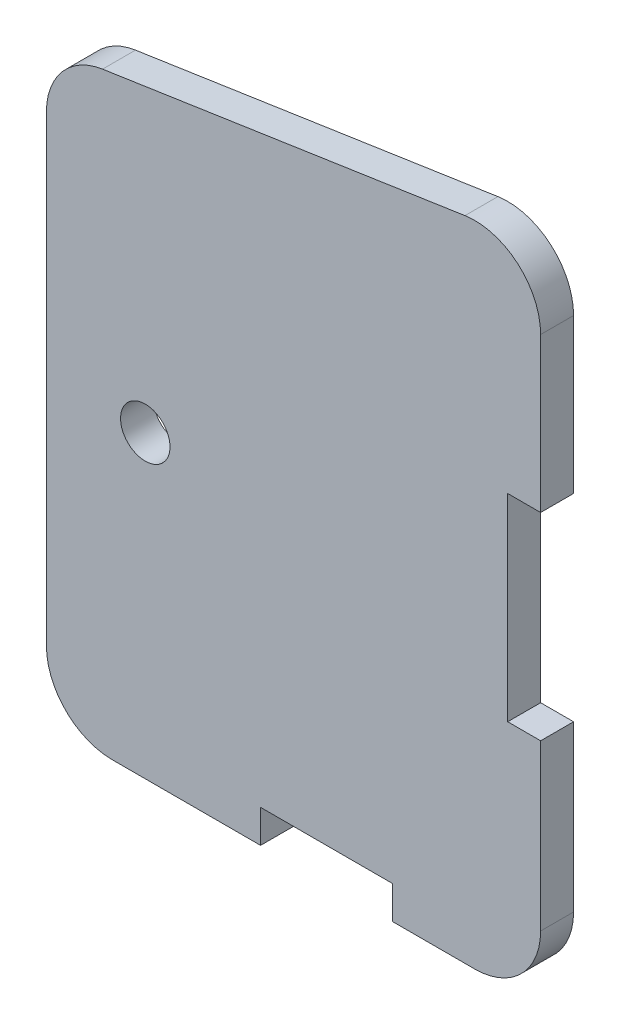
from build123d import *

# Parameters (mm, degrees)
BOSS_EXTRUDE1_DEPTH = 3.175


with BuildPart() as part:
    # Sketch1 → Boss-Extrude1 (new body)
    with BuildSketch(Plane.XY):
        with BuildLine():
            Line((-38.1, 31.27375), (-38.1, 57.785))
            Line((-38.1, 57.785), (-42.216961876, 57.167455719))
            ThreePointArc((-42.216961876, 57.167455719), (-46.086650336, 55.031442621), (-47.625, 50.887709878))
            Line((-47.625, 50.887709878), (-47.625, 6.35))
            ThreePointArc((-47.625, 6.35), (-45.765128061, 1.859871939), (-41.275, 0))
            Line((-41.275, 0), (-38.1, 0))
            Line((-38.1, 0), (-38.1, 26.51125))
            ThreePointArc((-38.1, 26.51125), (-40.48125, 28.8925), (-38.1, 31.27375))
        make_face()
        with BuildLine():
            Line((0, 41.275), (0, 56.126459878))
            ThreePointArc((0, 56.126459878), (-2.206267257, 60.938110214), (-7.291961876, 62.406205719))
            Line((-7.291961876, 62.406205719), (-38.1, 57.785))
            Line((-38.1, 57.785), (-38.1, 31.27375))
            ThreePointArc((-38.1, 31.27375), (-36.416201977, 30.576298023), (-35.71875, 28.8925))
            ThreePointArc((-35.71875, 28.8925), (-36.416201977, 27.208701977), (-38.1, 26.51125))
            Line((-38.1, 26.51125), (-38.1, 0))
            Line((-38.1, 0), (-26.9875, 0))
            Line((-26.9875, 0), (-26.9875, 3.175))
            Line((-26.9875, 3.175), (-14.2875, 3.175))
            Line((-14.2875, 3.175), (-14.2875, 0))
            Line((-14.2875, 0), (-6.35, 0))
            ThreePointArc((-6.35, 0), (-1.859871939, 1.859871939), (0, 6.35))
            Line((0, 6.35), (0, 22.225))
            Line((0, 22.225), (-3.175, 22.225))
            Line((-3.175, 22.225), (-3.175, 41.275))
            Line((-3.175, 41.275), (0, 41.275))
        make_face()
    extrude(amount=BOSS_EXTRUDE1_DEPTH)


solid = part.part
